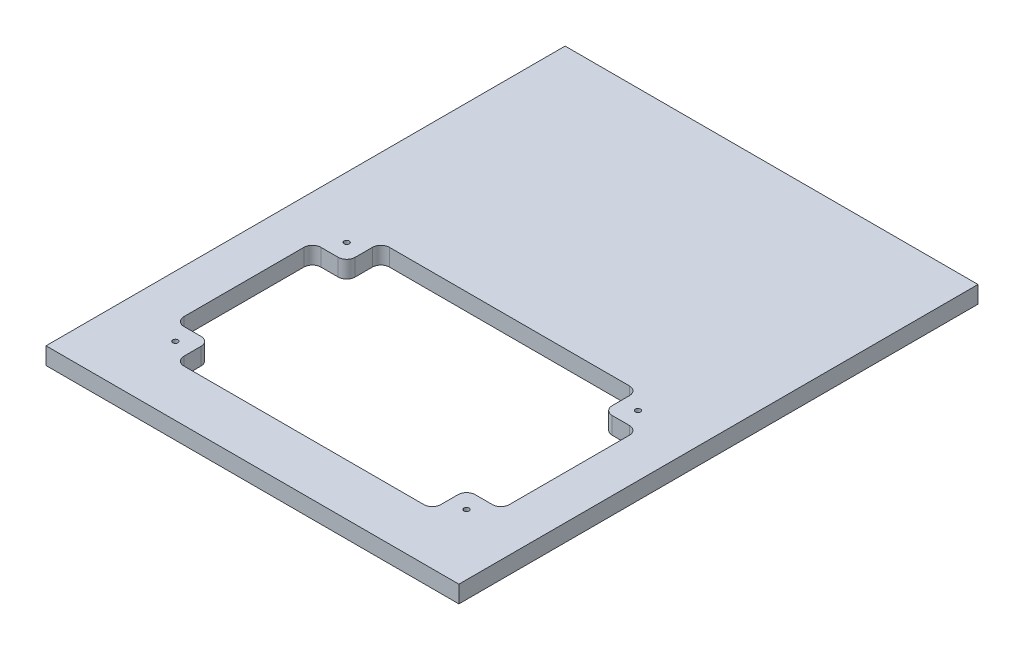
from build123d import *

# Parameters (mm, degrees)
SKETCH1_W           = 241
SKETCH1_H           = 303
BOSS_EXTRUDE1_DEPTH = 10
CUT_EXTRUDE1_DEPTH  = 388.285424461
SKETCH3_R           = 1.5
CUT_EXTRUDE2_DEPTH  = 10


with BuildPart() as part:
    # Sketch1 → Boss-Extrude1 (new body)
    with BuildSketch(Plane(origin=(0, 0, 0), x_dir=(1, 0, 0), z_dir=(0, 1, 0))):
        with Locations((120.5, 151.5)):
            Rectangle(SKETCH1_W, SKETCH1_H)
    extrude(amount=BOSS_EXTRUDE1_DEPTH)

    # Sketch2 → Cut-Extrude1 (cut, through all)
    with BuildSketch(Plane(origin=(0, 10, 0), x_dir=(1, 0, 0), z_dir=(0, 1, 0))):
        with BuildLine():
            Line((50.5, 150), (190.5, 150))
            ThreePointArc((190.5, 150), (194.035533906, 148.535533906), (195.5, 145))
            Line((195.5, 145), (195.5, 135))
            ThreePointArc((195.5, 135), (196.964466094, 131.464466094), (200.5, 130))
            Line((200.5, 130), (210.5, 130))
            ThreePointArc((210.5, 130), (214.035533906, 128.535533906), (215.5, 125))
            Line((215.5, 125), (215.5, 55))
            ThreePointArc((215.5, 55), (214.035533906, 51.464466094), (210.5, 50))
            Line((210.5, 50), (200.5, 50))
            ThreePointArc((200.5, 50), (196.964466094, 48.535533906), (195.5, 45))
            Line((195.5, 45), (195.5, 35))
            ThreePointArc((195.5, 35), (194.035533906, 31.464466094), (190.5, 30))
            Line((190.5, 30), (50.5, 30))
            ThreePointArc((50.5, 30), (46.964466094, 31.464466094), (45.5, 35))
            Line((45.5, 35), (45.5, 45))
            ThreePointArc((45.5, 45), (44.035533906, 48.535533906), (40.5, 50))
            Line((40.5, 50), (30.5, 50))
            ThreePointArc((30.5, 50), (26.964466094, 51.464466094), (25.5, 55))
            Line((25.5, 55), (25.5, 125))
            ThreePointArc((25.5, 125), (26.964466094, 128.535533906), (30.5, 130))
            Line((30.5, 130), (40.5, 130))
            ThreePointArc((40.5, 130), (44.035533906, 131.464466094), (45.5, 135))
            Line((45.5, 135), (45.5, 145))
            ThreePointArc((45.5, 145), (46.964466094, 148.535533906), (50.5, 150))
        make_face()
    extrude(amount=-CUT_EXTRUDE1_DEPTH, mode=Mode.SUBTRACT)

    # Sketch3 → Cut-Extrude2 (cut)
    with BuildSketch(Plane(origin=(0, 10, 0), x_dir=(1, 0, 0), z_dir=(0, 1, 0))):
        with Locations(Location((205.5, 140, 0), (0, 0, 270))):
            Circle(SKETCH3_R)
        with Locations(Location((35.5, 140, 0), (0, 0, 270))):
            Circle(SKETCH3_R)
        with Locations(Location((35.5, 40, 0), (0, 0, 270))):
            Circle(SKETCH3_R)
        with Locations(Location((205.5, 40, 0), (0, 0, 270))):
            Circle(SKETCH3_R)
    extrude(amount=-CUT_EXTRUDE2_DEPTH, mode=Mode.SUBTRACT)


solid = part.part
